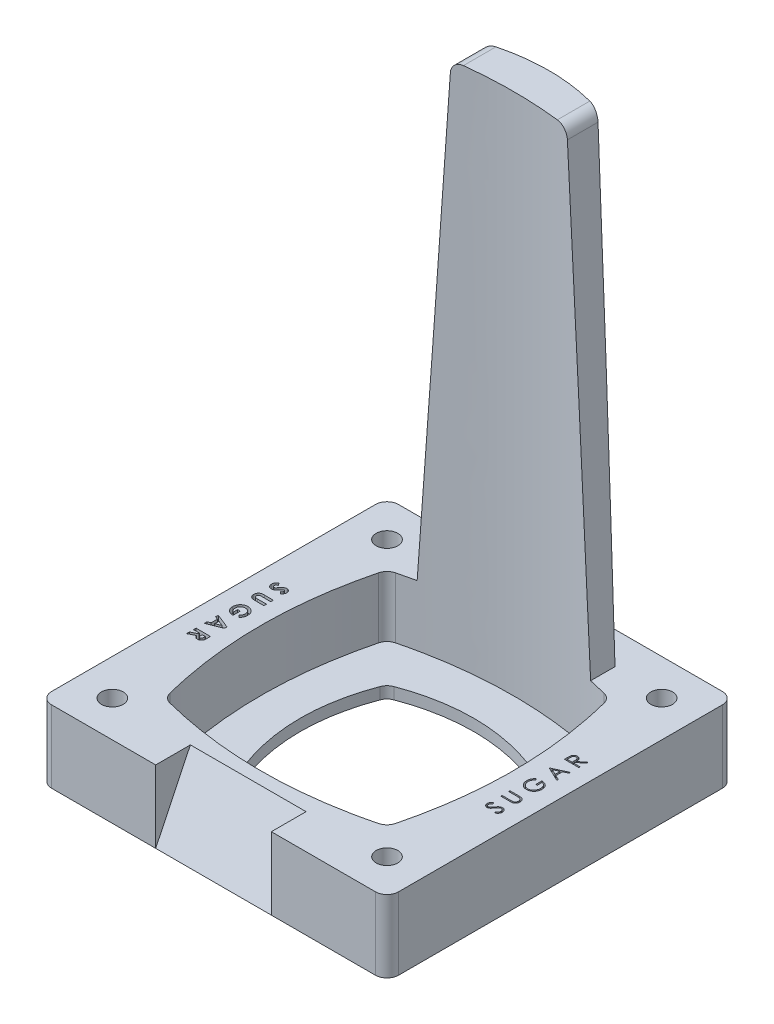
from build123d import *

# Parameters (mm, degrees)
SKETCH1_W           = 76.2
SKETCH1_H           = 76.2
BOSS_EXTRUDE1_DEPTH = 15.875
CUT_EXTRUDE1_DEPTH  = 13.335
SKETCH4_R           = 2.38125
CUT_EXTRUDE3_DEPTH  = 57.171484227
FILLET2_R           = 2.54
CUT_EXTRUDE4_DEPTH  = 56.507136865
FILLET3_R           = 2.54
BOSS_EXTRUDE2_DEPTH = 101.6
CUT_EXTRUDE5_DEPTH  = 130.242391125
FILLET4_R           = 2.54
CUT_EXTRUDE6_DEPTH  = 12.7
CUT_EXTRUDE7_DEPTH  = 1.27


with BuildPart() as part:
    # Sketch1 → Boss-Extrude1 (new body)
    with BuildSketch(Plane(origin=(0, 0, 0), x_dir=(1, 0, 0), z_dir=(0, 1, 0))):
        Rectangle(SKETCH1_W, SKETCH1_H)
    extrude(amount=BOSS_EXTRUDE1_DEPTH)

    # Sketch2 → Cut-Extrude1 (cut)
    with BuildSketch(Plane(origin=(0, 15.875, 0), x_dir=(1, 0, 0), z_dir=(0, 1, 0))):
        with BuildLine():
            add(Edge.make_bspline(
                [(-24.384, 24.384), (-30.988, 0), (-24.384, -24.384)],
                knots=[0, 0, 0, 1, 1, 1], degree=2))
            add(Edge.make_bspline(
                [(24.384, -24.384), (0, -30.988), (-24.384, -24.384)],
                knots=[0, 0, 0, 1, 1, 1], degree=2))
            add(Edge.make_bspline(
                [(24.384, 24.384), (30.988, 0), (24.384, -24.384)],
                knots=[0, 0, 0, 1, 1, 1], degree=2))
            add(Edge.make_bspline(
                [(-24.384, 24.384), (0, 30.988), (24.384, 24.384)],
                knots=[0, 0, 0, 1, 1, 1], degree=2))
        make_face()
    extrude(amount=-CUT_EXTRUDE1_DEPTH, mode=Mode.SUBTRACT)

    # Sketch4 → Cut-Extrude3 (cut, through all)
    with BuildSketch(Plane(origin=(0, 15.875, 0), x_dir=(1, 0, 0), z_dir=(0, 1, 0))):
        with Locations(Location((-30.1625, 30.1625, 0), (0, 0, 270))):
            Circle(SKETCH4_R)
        with Locations(Location((30.1625, 30.1625, 0), (0, 0, 270))):
            Circle(SKETCH4_R)
        with Locations(Location((30.1625, -30.1625, 0), (0, 0, 270))):
            Circle(SKETCH4_R)
        with Locations(Location((-30.1625, -30.1625, 0), (0, 0, 270))):
            Circle(SKETCH4_R)
    extrude(amount=-CUT_EXTRUDE3_DEPTH, mode=Mode.SUBTRACT)

    # Fillet2
    fillet2_edges = [part.edges().sort_by_distance(p)[0] for p in [
        (38.1, 7.9375, 38.1),
        (-38.1, 7.9375, 38.1),
        (-38.1, 7.9375, -38.1),
        (38.1, 7.9375, -38.1),
    ]]
    fillet(fillet2_edges, radius=FILLET2_R)

    # Sketch8 → Cut-Extrude4 (cut, through all)
    with BuildSketch(Plane(origin=(0, 2.54, 0), x_dir=(1, 0, 0), z_dir=(0, 1, 0))):
        with BuildLine():
            add(Edge.make_bspline(
                [(-15.875, 15.875), (-22.225, 0), (-15.875, -15.875)],
                knots=[0, 0, 0, 1, 1, 1], degree=2))
            add(Edge.make_bspline(
                [(15.875, -15.875), (0, -22.225), (-15.875, -15.875)],
                knots=[0, 0, 0, 1, 1, 1], degree=2))
            add(Edge.make_bspline(
                [(15.875, 15.875), (22.225, 0), (15.875, -15.875)],
                knots=[0, 0, 0, 1, 1, 1], degree=2))
            add(Edge.make_bspline(
                [(-15.875, 15.875), (0, 22.225), (15.875, 15.875)],
                knots=[0, 0, 0, 1, 1, 1], degree=2))
        make_face()
    extrude(amount=-CUT_EXTRUDE4_DEPTH, mode=Mode.SUBTRACT)

    # Fillet3
    fillet3_edges = [part.edges().sort_by_distance(p)[0] for p in [
        (15.875, 1.27, -15.875),
        (15.875, 1.27, 15.875),
        (-15.875, 1.27, 15.875),
        (-15.875, 1.27, -15.875),
        (-24.384, 9.2075, -24.384),
        (-24.384, 9.2075, 24.384),
        (24.384, 9.2075, 24.384),
        (24.384, 9.2075, -24.384),
    ]]
    fillet(fillet3_edges, radius=FILLET3_R)

    # Sketch9 → Boss-Extrude2 (add)
    with BuildSketch(Plane(origin=(0, 15.875, 0), x_dir=(1, 0, 0), z_dir=(0, 1, 0))):
        with BuildLine():
            Line((-26.67, 26.67), (-24.384, 24.384))
            add(Edge.make_bspline(
                [(-24.384, 24.384), (0, 30.988), (24.384, 24.384)],
                knots=[0, 0, 0, 1, 1, 1], degree=2))
            Line((24.384, 24.384), (26.67, 26.67))
            add(Edge.make_bspline(
                [(-26.67, 26.67), (0, 44.45), (26.67, 26.67)],
                knots=[0, 0, 0, 1, 1, 1], degree=2))
        make_face()
    extrude(amount=BOSS_EXTRUDE2_DEPTH)

    # Sketch10 → Cut-Extrude5 (cut, through all)
    with BuildSketch(Plane.XY):
        Polygon((-12.7, 117.475), (-19.05, 15.875), (-26.67, 15.875), (-26.67, 117.475), align=None)
        Polygon((12.7, 117.475), (19.05, 15.875), (26.67, 15.875), (26.67, 117.475), align=None)
    extrude(amount=-CUT_EXTRUDE5_DEPTH, mode=Mode.SUBTRACT)

    # Fillet4
    fillet4_edges = [part.edges().sort_by_distance(p)[0] for p in [
        (12.7, 117.475, -30.167201079),
        (-12.7, 117.475, -30.167201079),
    ]]
    fillet(fillet4_edges, radius=FILLET4_R)

    # Sketch11 → Cut-Extrude6 (cut, symmetric)
    with BuildSketch(Plane(origin=(0, 0, 0), x_dir=(0, 0, -1), z_dir=(1, 0, 0))):
        Polygon((-30.48, 15.875), (-38.1, 0), (-38.1, 15.875), align=None)
    extrude(amount=CUT_EXTRUDE6_DEPTH, both=True, mode=Mode.SUBTRACT)

    # Sketch12 → Cut-Extrude7 (cut)
    # profile 1 of 10: a face of its own
    with BuildSketch(Plane(origin=(0, 15.875, 0), x_dir=(1, 0, 0), z_dir=(0, 1, 0))):
        with BuildLine():
            Line((-31.539223758, 8.141025641), (-31.929102564, 8.567157452))
            add(Edge.make_bspline(
                [(-31.929102564, 8.567157452), (-31.90334928, 8.585407599), (-31.853906565, 8.620445336), (-31.787773878, 8.677294942), (-31.730987674, 8.733804911), (-31.685171539, 8.791130647), (-31.648288106, 8.848285183), (-31.622848116, 8.906482796), (-31.606487506, 8.965053963), (-31.604460135, 9.004425412), (-31.603461538, 9.023818109)],
                knots=[0, 0, 0, 0, 1.299459705, 2.494781419, 3.587730629, 4.594196874, 5.512431013, 6.380462003, 7.202284646, 8, 8, 8, 8], degree=3))
            add(Edge.make_bspline(
                [(-31.603461538, 9.023818109), (-31.604095863, 9.041905542), (-31.605320578, 9.076827623), (-31.617494153, 9.126611641), (-31.638503956, 9.1708106), (-31.66597604, 9.209381366), (-31.699073533, 9.239935103), (-31.733784293, 9.264329893), (-31.772097121, 9.278066209), (-31.798411918, 9.279874179), (-31.811439303, 9.280769231)],
                knots=[0, 0, 0, 0, 1.185010067, 2.2879431, 3.333075148, 4.379039566, 5.372662701, 6.27520591, 7.14612461, 8, 8, 8, 8], degree=3))
            add(Edge.make_bspline(
                [(-31.811439303, 9.280769231), (-31.824654549, 9.280208347), (-31.851268217, 9.279078805), (-31.890273863, 9.268168966), (-31.92838692, 9.251724724), (-31.951588151, 9.236011579), (-31.963447516, 9.227979768)],
                knots=[0, 0, 0, 0, 0.967525499, 1.948461899, 2.951351359, 4, 4, 4, 4], degree=3))
            add(Edge.make_bspline(
                [(-31.963447516, 9.227979768), (-31.972664567, 9.220676914), (-31.993881002, 9.20386671), (-32.027514428, 9.17184267), (-32.068440273, 9.131570126), (-32.116434363, 9.082221977), (-32.170871405, 9.023858767), (-32.232069818, 8.955963965), (-32.300413726, 8.879496815), (-32.348070362, 8.825207766), (-32.373042869, 8.796759816)],
                knots=[0, 0, 0, 0, 0.473868417, 1.090782513, 1.870421581, 2.78911798, 3.865477667, 5.087766164, 6.473963263, 8, 8, 8, 8], degree=3))
            add(Edge.make_bspline(
                [(-32.373042869, 8.796759816), (-32.396157108, 8.770052033), (-32.440023131, 8.71936621), (-32.502283908, 8.647250348), (-32.558298411, 8.583872517), (-32.607225982, 8.528309445), (-32.649579984, 8.481403415), (-32.685562867, 8.442957234), (-32.714474112, 8.412501346), (-32.731936522, 8.395188957), (-32.739389022, 8.387800481)],
                knots=[0, 0, 0, 0, 1.543621617, 2.929473131, 4.163658386, 5.240097082, 6.164993805, 6.925417477, 7.541396219, 8, 8, 8, 8], degree=3))
            add(Edge.make_bspline(
                [(-32.739389022, 8.387800481), (-32.769712969, 8.359754162), (-32.828006242, 8.305839289), (-32.918609813, 8.235949035), (-33.006450958, 8.177552189), (-33.094228703, 8.132848154), (-33.182997385, 8.100125542), (-33.274285521, 8.076158756), (-33.369659972, 8.062006264), (-33.434721592, 8.060418475), (-33.467629207, 8.059615385)],
                knots=[0, 0, 0, 0, 1.20648512, 2.3192881, 3.339983362, 4.284774958, 5.190427137, 6.099526693, 7.038756749, 8, 8, 8, 8], degree=3))
            add(Edge.make_bspline(
                [(-33.467629207, 8.059615385), (-33.499695024, 8.060184102), (-33.562609351, 8.061299946), (-33.654679367, 8.074952099), (-33.742778036, 8.094447091), (-33.826022738, 8.124486592), (-33.905400171, 8.161407444), (-33.980936356, 8.206405284), (-34.050870359, 8.26141879), (-34.117079432, 8.322525938), (-34.17653746, 8.391161331), (-34.228852022, 8.465010762), (-34.273370098, 8.54393633), (-34.308628113, 8.628232495), (-34.336940573, 8.717383256), (-34.357059122, 8.811501316), (-34.369491274, 8.910696744), (-34.370761379, 8.978411426), (-34.371410256, 9.013005809)],
                knots=[0, 0, 0, 0, 1.043082113, 2.046565928, 3.024368146, 3.976196322, 4.921091788, 5.871642728, 6.831173094, 7.81279273, 8.801063391, 9.781590382, 10.755046466, 11.74476232, 12.751114423, 13.796272686, 14.874149815, 16, 16, 16, 16], degree=3))
            add(Edge.make_bspline(
                [(-34.371410256, 9.013005809), (-34.370928674, 9.040160522), (-34.369974864, 9.093942427), (-34.362182929, 9.173207696), (-34.349619668, 9.249751594), (-34.331570529, 9.323467822), (-34.308908965, 9.394574787), (-34.280708006, 9.463006394), (-34.247515147, 9.528690183), (-34.209311506, 9.592049092), (-34.164977118, 9.652646409), (-34.115433842, 9.711296813), (-34.059607727, 9.767267726), (-33.998587537, 9.821707113), (-33.930809473, 9.87269009), (-33.858228699, 9.922830747), (-33.779134234, 9.969702021), (-33.723659024, 9.998666914), (-33.695323518, 10.013461538)],
                knots=[0, 0, 0, 0, 1.016957334, 2.014158747, 2.980235577, 3.920141478, 4.854360818, 5.773095257, 6.689355356, 7.608638744, 8.541033765, 9.498850575, 10.481527934, 11.499755671, 12.559141621, 13.65604909, 14.802761907, 16, 16, 16, 16], degree=3))
            Line((-33.695323518, 10.013461538), (-33.394487179, 9.512279647))
            add(Edge.make_bspline(
                [(-33.394487179, 9.512279647), (-33.426652663, 9.493775012), (-33.488316645, 9.458300045), (-33.57117002, 9.398184396), (-33.642120221, 9.336598982), (-33.699913198, 9.272120005), (-33.745321719, 9.205531504), (-33.777773798, 9.136511841), (-33.797861598, 9.065012525), (-33.800314782, 9.016310439), (-33.801538462, 8.992017228)],
                knots=[0, 0, 0, 0, 1.283663364, 2.460892379, 3.537111102, 4.529833553, 5.449777664, 6.316464042, 7.160231139, 8, 8, 8, 8], degree=3))
            add(Edge.make_bspline(
                [(-33.801538462, 8.992017228), (-33.800548635, 8.967303003), (-33.798628227, 8.919353808), (-33.78053993, 8.850799796), (-33.75277678, 8.787671422), (-33.712399548, 8.733397051), (-33.666357758, 8.687307677), (-33.61442987, 8.654266332), (-33.5589196, 8.632833567), (-33.520183941, 8.63060701), (-33.500702123, 8.629487179)],
                knots=[0, 0, 0, 0, 1.13537643, 2.202795631, 3.242191317, 4.290390765, 5.297919085, 6.223733717, 7.106639842, 8, 8, 8, 8], degree=3))
            add(Edge.make_bspline(
                [(-33.500702123, 8.629487179), (-33.482586559, 8.630535373), (-33.445786526, 8.632664677), (-33.391039028, 8.64826312), (-33.336556999, 8.672852869), (-33.291396406, 8.701072495), (-33.253753173, 8.730492975), (-33.221627446, 8.759330681), (-33.185391531, 8.79350835), (-33.146033543, 8.833896849), (-33.102796752, 8.879710627), (-33.055783958, 8.93109967), (-33.005378385, 8.988617389), (-32.971044009, 9.02927266), (-32.953090946, 9.050530849)],
                knots=[0, 0, 0, 0, 0.916057066, 1.860882232, 2.859899639, 3.934694552, 4.546382938, 5.276161949, 6.118633209, 7.067046139, 8.129668089, 9.306861125, 10.591787583, 12, 12, 12, 12], degree=3))
            add(Edge.make_bspline(
                [(-32.953090946, 9.050530849), (-32.918896967, 9.090941967), (-32.853268374, 9.168503134), (-32.756356584, 9.278127012), (-32.665714834, 9.376837279), (-32.580623832, 9.463983851), (-32.501608539, 9.539799125), (-32.42942167, 9.605201374), (-32.362598747, 9.65876647), (-32.283317923, 9.715076786), (-32.187216408, 9.769438979), (-32.070979105, 9.815548253), (-31.955004328, 9.845630872), (-31.877121446, 9.84898845), (-31.838788061, 9.850641026)],
                knots=[0, 0, 0, 0, 1.34561873, 2.582649632, 3.719171478, 4.751946187, 5.678152813, 6.502542634, 7.227205346, 7.853698961, 8.973370308, 10.023159194, 11.027013428, 12, 12, 12, 12], degree=3))
            add(Edge.make_bspline(
                [(-31.838788061, 9.850641026), (-31.811605937, 9.849951217), (-31.758054232, 9.848592221), (-31.679305232, 9.836505232), (-31.603354152, 9.81835775), (-31.530224114, 9.792275067), (-31.460724416, 9.757304368), (-31.393785558, 9.715948535), (-31.329524181, 9.66735393), (-31.270035587, 9.610950817), (-31.214773717, 9.54976376), (-31.166266245, 9.484229394), (-31.125470412, 9.415032002), (-31.09113176, 9.342661067), (-31.065288948, 9.266186565), (-31.046806835, 9.186303502), (-31.03584309, 9.102988861), (-31.034350217, 9.046323442), (-31.033589744, 9.017457933)],
                knots=[0, 0, 0, 0, 1.010961173, 1.991702108, 2.958025473, 3.913824419, 4.873522744, 5.847800578, 6.838738273, 7.865764422, 8.893759806, 9.903642949, 10.894078012, 11.878777586, 12.879248405, 13.891624672, 14.925988217, 16, 16, 16, 16], degree=3))
            add(Edge.make_bspline(
                [(-31.033589744, 9.017457933), (-31.034961925, 8.98005114), (-31.037695458, 8.905532832), (-31.058958268, 8.795322228), (-31.092751805, 8.687622238), (-31.132550524, 8.60056001), (-31.172352352, 8.53189815), (-31.208195551, 8.479098689), (-31.249513552, 8.425267638), (-31.296471034, 8.370127576), (-31.348754388, 8.313958719), (-31.407426808, 8.257233689), (-31.470575803, 8.198570656), (-31.515940238, 8.160543346), (-31.539223758, 8.141025641)],
                knots=[0, 0, 0, 0, 1.282867522, 2.555608537, 3.83715526, 5.14906667, 5.830341525, 6.558732832, 7.337173124, 8.157810814, 9.043130442, 9.96912168, 10.957641678, 12, 12, 12, 12], degree=3))
        make_face()
    # profile 2 of 10: a face of its own
    with BuildSketch(Plane(origin=(0, 15.875, 0), x_dir=(1, 0, 0), z_dir=(0, 1, 0))):
        with BuildLine():
            Line((-31.115, 6.146474359), (-31.115, 5.576602564))
            Line((-31.115, 5.576602564), (-33.180785256, 5.576602564))
            add(Edge.make_bspline(
                [(-33.180785256, 5.576602564), (-33.202202422, 5.576571577), (-33.243569456, 5.576511727), (-33.302917606, 5.573515568), (-33.357470982, 5.570773877), (-33.40716986, 5.565827088), (-33.452035499, 5.558518984), (-33.4923561, 5.551442356), (-33.527409768, 5.541864839), (-33.56731002, 5.527471362), (-33.612140132, 5.505295738), (-33.658863104, 5.469062), (-33.701504597, 5.427251366), (-33.73699776, 5.377138914), (-33.76570853, 5.320816948), (-33.786980033, 5.258594935), (-33.798804165, 5.190560584), (-33.800609335, 5.143518562), (-33.801538462, 5.119305889)],
                knots=[0, 0, 0, 0, 1.155499968, 2.231836252, 3.205919964, 4.102923608, 4.924856345, 5.658536265, 6.31071849, 6.882491295, 7.94666036, 8.992281882, 10.060072772, 11.158554251, 12.289267114, 13.461410017, 14.693379945, 16, 16, 16, 16], degree=3))
            add(Edge.make_bspline(
                [(-33.801538462, 5.119305889), (-33.80079594, 5.093579872), (-33.799348149, 5.043418495), (-33.78483015, 4.971122749), (-33.762251333, 4.903953897), (-33.729368132, 4.843747125), (-33.690550649, 4.790285194), (-33.645226481, 4.745930734), (-33.595712002, 4.709401525), (-33.549093163, 4.686439452), (-33.506592712, 4.673119022), (-33.46829166, 4.664400576), (-33.423479502, 4.656898024), (-33.372354731, 4.650509499), (-33.314586014, 4.646567357), (-33.250590154, 4.642342432), (-33.179944343, 4.640786476), (-33.130751637, 4.640522349), (-33.105099159, 4.640384615)],
                knots=[0, 0, 0, 0, 1.260838023, 2.458420682, 3.603291091, 4.724957099, 5.81103668, 6.833527554, 7.823976978, 8.819602765, 9.36572267, 10.006654001, 10.745469399, 11.594489782, 12.533565386, 13.586096035, 14.741223574, 16, 16, 16, 16], degree=3))
            Line((-33.105099159, 4.640384615), (-31.115, 4.640384615))
            Line((-31.115, 4.640384615), (-31.115, 4.070512821))
            Line((-31.115, 4.070512821), (-33.009060497, 4.070512821))
            add(Edge.make_bspline(
                [(-33.009060497, 4.070512821), (-33.047434781, 4.070581715), (-33.121224787, 4.070714193), (-33.227254913, 4.07318609), (-33.324148949, 4.077714324), (-33.411731269, 4.083335295), (-33.490252067, 4.090075968), (-33.559671284, 4.098799573), (-33.619951709, 4.109471005), (-33.688565593, 4.125464537), (-33.767574304, 4.15302781), (-33.858548604, 4.197478052), (-33.947617534, 4.253901256), (-34.033804373, 4.320590244), (-34.113858845, 4.395893437), (-34.184173435, 4.478116775), (-34.243412889, 4.565886123), (-34.290927405, 4.659916609), (-34.327643501, 4.760879679), (-34.352196692, 4.869484694), (-34.368993762, 4.985434358), (-34.370588612, 5.065392329), (-34.371410256, 5.106585537)],
                knots=[0, 0, 0, 0, 1.170789758, 2.251314523, 3.23554622, 4.130075238, 4.928857907, 5.639700176, 6.263954887, 6.795817153, 7.787924184, 8.809125334, 9.87873356, 10.999178519, 12.129364722, 13.22595565, 14.293390689, 15.352147651, 16.432536881, 17.562186165, 18.74407303, 20, 20, 20, 20], degree=3))
            add(Edge.make_bspline(
                [(-34.371410256, 5.106585537), (-34.370949212, 5.133954476), (-34.370039582, 5.187952831), (-34.362020604, 5.267367315), (-34.350199982, 5.344135367), (-34.332968165, 5.418120412), (-34.310661146, 5.48955127), (-34.283442466, 5.55833452), (-34.250672885, 5.624029009), (-34.213823489, 5.686865402), (-34.173431871, 5.746524137), (-34.129400523, 5.801608656), (-34.083617134, 5.852890513), (-34.035135156, 5.89944726), (-33.984135741, 5.94157942), (-33.930560017, 5.979245157), (-33.874397873, 6.012376723), (-33.814640936, 6.041810659), (-33.74825091, 6.067003073), (-33.672866573, 6.088241273), (-33.587306262, 6.106795448), (-33.491377241, 6.120583821), (-33.385395674, 6.133084439), (-33.269085464, 6.140996642), (-33.142443274, 6.145135871), (-33.054644869, 6.146016923), (-33.009060497, 6.146474359)],
                knots=[0, 0, 0, 0, 1.001195678, 1.975338534, 2.91783225, 3.841754112, 4.752027347, 5.653798756, 6.545402703, 7.435486725, 8.317659034, 9.179053568, 10.013983148, 10.831468265, 11.636005169, 12.432309474, 13.225243684, 14.019732185, 14.86686161, 15.819485008, 16.883051984, 18.067941734, 19.364090787, 20.787286826, 22.331979793, 24, 24, 24, 24], degree=3))
            Line((-33.009060497, 6.146474359), (-31.115, 6.146474359))
        make_face()
    # profile 3 of 10: a face of its own
    with BuildSketch(Plane(origin=(0, 15.875, 0), x_dir=(1, 0, 0), z_dir=(0, 1, 0))):
        with BuildLine():
            Line((-31.619997997, -0.915229367), (-32.032773438, -0.484009415))
            add(Edge.make_bspline(
                [(-32.032773438, -0.484009415), (-31.998592095, -0.449868979), (-31.931522658, -0.382879807), (-31.844227177, -0.273327396), (-31.770008761, -0.159864347), (-31.708981187, -0.042117207), (-31.661642895, 0.080078047), (-31.6277803, 0.20648027), (-31.607695822, 0.337295104), (-31.604884063, 0.425850907), (-31.603461538, 0.470653045)],
                knots=[0, 0, 0, 0, 1.075575784, 2.110457258, 3.113929901, 4.09197124, 5.059417775, 6.02750972, 7.002078037, 8, 8, 8, 8], degree=3))
            add(Edge.make_bspline(
                [(-31.603461538, 0.470653045), (-31.604458351, 0.509495087), (-31.606415679, 0.585764841), (-31.62127787, 0.69783661), (-31.646108724, 0.804925325), (-31.68049312, 0.907549707), (-31.725291024, 1.005036225), (-31.779489678, 1.097977311), (-31.844445032, 1.185310883), (-31.917538405, 1.267410327), (-31.997944993, 1.342000646), (-32.083266332, 1.408023395), (-32.17331387, 1.46348306), (-32.267575185, 1.509276103), (-32.366235758, 1.544071229), (-32.46916554, 1.56892282), (-32.576081131, 1.584694306), (-32.649019467, 1.586556685), (-32.685963542, 1.5875)],
                knots=[0, 0, 0, 0, 1.075079404, 2.111012651, 3.123248818, 4.114352675, 5.101852729, 6.0883232, 7.087285529, 8.109865155, 9.127328517, 10.119283532, 11.091685968, 12.049813832, 13.015105368, 13.981662908, 14.977689899, 16, 16, 16, 16], degree=3))
            add(Edge.make_bspline(
                [(-32.685963542, 1.5875), (-32.724183965, 1.586613998), (-32.799483432, 1.584868452), (-32.910029757, 1.568306159), (-33.016154184, 1.542343185), (-33.117980416, 1.505998354), (-33.215218951, 1.458618363), (-33.307705664, 1.400283143), (-33.395850515, 1.33185493), (-33.478437945, 1.253928512), (-33.554538695, 1.169126299), (-33.620230624, 1.077310422), (-33.676655071, 0.981345383), (-33.722015779, 0.879676119), (-33.757587872, 0.773599475), (-33.783161363, 0.662443386), (-33.798706634, 0.546570012), (-33.800585123, 0.467521319), (-33.801538462, 0.427403846)],
                knots=[0, 0, 0, 0, 1.022020332, 2.013519966, 2.983415422, 3.94151226, 4.900448282, 5.871487551, 6.861996943, 7.881274692, 8.905826162, 9.905469932, 10.896823527, 11.879375057, 12.878487611, 13.885682746, 14.926976999, 16, 16, 16, 16], degree=3))
            add(Edge.make_bspline(
                [(-33.801538462, 0.427403846), (-33.801302776, 0.401308418), (-33.800840072, 0.350077287), (-33.793339692, 0.274928335), (-33.782600639, 0.202959794), (-33.768440666, 0.133864796), (-33.748134477, 0.068251647), (-33.725155673, 0.005229888), (-33.696685927, -0.054372687), (-33.664377774, -0.111075516), (-33.627167763, -0.16493001), (-33.585223239, -0.215762193), (-33.538162345, -0.263743175), (-33.486887221, -0.309699671), (-33.429900242, -0.35207138), (-33.368614053, -0.392357088), (-33.302349655, -0.430028032), (-33.255559944, -0.452289155), (-33.231666667, -0.463656851)],
                knots=[0, 0, 0, 0, 1.109467577, 2.178131716, 3.208562196, 4.204278576, 5.174223432, 6.127254264, 7.054993225, 7.9799672, 8.900446918, 9.835649638, 10.779420865, 11.756673556, 12.761211291, 13.796640546, 14.874849225, 16, 16, 16, 16], degree=3))
            Line((-33.231666667, -0.463656851), (-33.231666667, 0.44775641))
            Line((-33.231666667, 0.44775641), (-32.661794872, 0.44775641))
            Line((-32.661794872, 0.44775641), (-32.661794872, -1.135291466))
            Line((-32.661794872, -1.135291466), (-32.797266627, -1.13974359))
            add(Edge.make_bspline(
                [(-32.797266627, -1.13974359), (-32.832059211, -1.139171525), (-32.901582288, -1.138028416), (-33.005090307, -1.127581603), (-33.107225506, -1.110276616), (-33.207885304, -1.086619043), (-33.307563474, -1.056970118), (-33.405305513, -1.019158459), (-33.501774275, -0.974881236), (-33.596559844, -0.92527175), (-33.687509174, -0.869524961), (-33.773626184, -0.809505357), (-33.854761824, -0.746068559), (-33.92978567, -0.677834842), (-33.999327956, -0.605866718), (-34.063121145, -0.530022516), (-34.121219214, -0.45003398), (-34.174112958, -0.366324841), (-34.220471204, -0.278418294), (-34.260796728, -0.186797649), (-34.295044344, -0.091601242), (-34.323119939, 0.007416702), (-34.344782494, 0.110061342), (-34.359636537, 0.216334876), (-34.369730026, 0.32629567), (-34.370843408, 0.40087975), (-34.371410256, 0.438852163)],
                knots=[0, 0, 0, 0, 1.006889344, 2.011981806, 3.007738725, 4.003571281, 5.003404394, 6.015442001, 7.03424805, 8.074616296, 9.110249922, 10.119753985, 11.111721717, 12.089233633, 13.052717867, 14.006597561, 14.955430184, 15.912305663, 16.870361111, 17.829300583, 18.807640451, 19.796414044, 20.806216501, 21.841577364, 22.90109906, 24, 24, 24, 24], degree=3))
            add(Edge.make_bspline(
                [(-34.371410256, 0.438852163), (-34.370845251, 0.479365208), (-34.369725242, 0.559674146), (-34.359427003, 0.678229113), (-34.342015673, 0.793484217), (-34.318697713, 0.905259317), (-34.288623424, 1.014048673), (-34.252151308, 1.119444216), (-34.2075171, 1.221063889), (-34.157798181, 1.31954387), (-34.100869474, 1.413655447), (-34.038860035, 1.503447217), (-33.970426627, 1.587694113), (-33.896268534, 1.666748891), (-33.817030529, 1.741173337), (-33.731646949, 1.810239125), (-33.640942221, 1.874567435), (-33.544313503, 1.932582811), (-33.444398872, 1.985273217), (-33.341786446, 2.031164345), (-33.237271689, 2.070067381), (-33.130831693, 2.101952853), (-33.022468999, 2.1267531), (-32.912249372, 2.144753312), (-32.800000237, 2.154858657), (-32.724567596, 2.156530363), (-32.686599559, 2.157371795)],
                knots=[0, 0, 0, 0, 1.084269852, 2.149346245, 3.182248965, 4.202856654, 5.203774155, 6.201646532, 7.185249156, 8.172511953, 9.152555749, 10.126997366, 11.091273046, 12.05486384, 13.026475683, 13.998733638, 14.992239644, 16.000514163, 17.013329872, 18.014183023, 19.007154045, 19.996420909, 20.986208491, 21.980735032, 22.983629316, 24, 24, 24, 24], degree=3))
            add(Edge.make_bspline(
                [(-32.686599559, 2.157371795), (-32.634802517, 2.156246696), (-32.532518714, 2.154024959), (-32.381854024, 2.133448306), (-32.23610097, 2.101372369), (-32.095790374, 2.055340169), (-31.960728957, 1.996269987), (-31.830599655, 1.924998605), (-31.705540786, 1.839977854), (-31.628111977, 1.774165953), (-31.588833133, 1.740780248)],
                knots=[0, 0, 0, 0, 1.034044851, 2.041932006, 3.031217818, 4.011390712, 4.986069675, 5.97149666, 6.970960976, 8, 8, 8, 8], degree=3))
            add(Edge.make_bspline(
                [(-31.588833133, 1.740780248), (-31.566109131, 1.72005139), (-31.52100233, 1.678904919), (-31.458325511, 1.613132359), (-31.399406982, 1.545691789), (-31.345496075, 1.475649145), (-31.295412652, 1.40337263), (-31.250095569, 1.328654218), (-31.208101904, 1.251885865), (-31.171576014, 1.172468871), (-31.138827506, 1.090818994), (-31.111117664, 1.006574621), (-31.08657333, 0.920366725), (-31.067901387, 0.83143193), (-31.052352818, 0.740668692), (-31.041931353, 0.647432742), (-31.034293161, 0.551978154), (-31.033826071, 0.487417472), (-31.033589744, 0.454752604)],
                knots=[0, 0, 0, 0, 1.020590567, 2.025856924, 3.013483481, 3.991664875, 4.957826714, 5.930500614, 6.890802512, 7.860442893, 8.829981142, 9.809047939, 10.802672283, 11.803273349, 12.823572789, 13.857849586, 14.916166035, 16, 16, 16, 16], degree=3))
            add(Edge.make_bspline(
                [(-31.033589744, 0.454752604), (-31.034116324, 0.420607212), (-31.035164026, 0.352670419), (-31.042413442, 0.251659659), (-31.053597581, 0.152052512), (-31.070374429, 0.05426873), (-31.091063774, -0.042019847), (-31.117571945, -0.136314808), (-31.147690003, -0.229231311), (-31.171702344, -0.289719603), (-31.183689904, -0.319916867)],
                knots=[0, 0, 0, 0, 1.03180557, 2.052914215, 3.058998889, 4.059601663, 5.049854447, 6.033765722, 7.018406786, 8, 8, 8, 8], degree=3))
            add(Edge.make_bspline(
                [(-31.183689904, -0.319916867), (-31.194768567, -0.34532413), (-31.217302261, -0.397001799), (-31.258528711, -0.472186438), (-31.304232962, -0.547554774), (-31.356086068, -0.622293544), (-31.41399104, -0.696288868), (-31.477033278, -0.770313334), (-31.545947891, -0.843611274), (-31.594994961, -0.891047501), (-31.619997997, -0.915229367)],
                knots=[0, 0, 0, 0, 0.894392155, 1.819168899, 2.76525314, 3.739198753, 4.75366411, 5.797420238, 6.877176959, 8, 8, 8, 8], degree=3))
        make_face()
    # profile 4 of 10: a face of its own
    with BuildSketch(Plane(origin=(0, 15.875, 0), x_dir=(1, 0, 0), z_dir=(0, 1, 0))):
        Polygon((-31.115, -4.03044371), (-31.115, -4.558974359), (-34.29, -5.841185897), (-34.29, -5.232517027), (-33.638717949, -4.985742187), (-33.638717949, -3.602403846), (-34.29, -3.355629006), (-34.29, -2.747596154), align=None)
        Polygon((-31.966627604, -4.294391026), (-33.068846154, -3.81864984), (-33.068846154, -4.770132212), align=None, mode=Mode.SUBTRACT)
    # profile 5 of 10: a face of its own
    with BuildSketch(Plane(origin=(0, 15.875, 0), x_dir=(1, 0, 0), z_dir=(0, 1, 0))):
        with BuildLine():
            Line((-31.115, -7.652564103), (-31.115, -8.316566506))
            add(Edge.make_bspline(
                [(-31.115, -8.316566506), (-31.115155307, -8.360456933), (-31.115454007, -8.444870588), (-31.120187542, -8.566589342), (-31.12674457, -8.678408734), (-31.136873334, -8.780685816), (-31.149971029, -8.873015925), (-31.165861196, -8.955594617), (-31.183812761, -9.028469844), (-31.205815187, -9.092625838), (-31.231153419, -9.150363716), (-31.259752993, -9.204032837), (-31.292694594, -9.254579235), (-31.328643444, -9.302930679), (-31.368887102, -9.348224121), (-31.413099442, -9.390334064), (-31.460961781, -9.429801971), (-31.512186312, -9.46668007), (-31.566701524, -9.499497366), (-31.623733346, -9.528571871), (-31.683435891, -9.552459308), (-31.745467376, -9.572349141), (-31.809902394, -9.587663102), (-31.87669911, -9.598060715), (-31.94588592, -9.605748798), (-31.99289378, -9.606186818), (-32.016872997, -9.606410256)],
                knots=[0, 0, 0, 0, 1.749037589, 3.363891962, 4.853828513, 6.212420965, 7.458679178, 8.568887289, 9.562757098, 10.447168552, 11.268163578, 12.073310924, 12.867792413, 13.67045336, 14.472446998, 15.279188696, 16.101356728, 16.943088626, 17.792208908, 18.634830833, 19.491484118, 20.351879174, 21.228996054, 22.12769993, 23.044919519, 24, 24, 24, 24], degree=3))
            add(Edge.make_bspline(
                [(-32.016872997, -9.606410256), (-32.041901303, -9.605826091), (-32.090977249, -9.604680648), (-32.163065812, -9.598510672), (-32.232035106, -9.587233894), (-32.297683199, -9.570153573), (-32.360827157, -9.550521962), (-32.420301934, -9.524416955), (-32.476972505, -9.494954875), (-32.530037244, -9.459963624), (-32.580674824, -9.421562435), (-32.626945132, -9.37690266), (-32.671335022, -9.328877566), (-32.711064061, -9.274787488), (-32.748818583, -9.217016767), (-32.783034235, -9.15441756), (-32.814571119, -9.087398409), (-32.832158263, -9.040280628), (-32.841151843, -9.016185897)],
                knots=[0, 0, 0, 0, 1.099860209, 2.156625411, 3.176576793, 4.16617041, 5.135385252, 6.078461593, 7.016046972, 7.938469504, 8.868247731, 9.803980173, 10.76021508, 11.73834243, 12.748633912, 13.790971185, 14.870363756, 16, 16, 16, 16], degree=3))
            Line((-32.841151843, -9.016185897), (-34.29, -9.748878205))
            Line((-34.29, -9.748878205), (-34.29, -9.115404647))
            Line((-34.29, -9.115404647), (-32.906025641, -8.415785256))
            Line((-32.906025641, -8.415785256), (-32.906025641, -8.222435897))
            Line((-32.906025641, -8.222435897), (-34.29, -8.222435897))
            Line((-34.29, -8.222435897), (-34.29, -7.652564103))
            Line((-34.29, -7.652564103), (-31.115, -7.652564103))
        make_face()
        with BuildLine():
            Line((-32.336153846, -8.222435897), (-32.336153846, -8.44440605))
            add(Edge.make_bspline(
                [(-32.336153846, -8.44440605), (-32.335848208, -8.47154375), (-32.335262976, -8.523506616), (-32.332548329, -8.598235972), (-32.326007705, -8.666108291), (-32.317743006, -8.727413994), (-32.308202923, -8.782464923), (-32.294522214, -8.830759344), (-32.279889692, -8.87307537), (-32.261618104, -8.908805429), (-32.24120474, -8.939456946), (-32.216991472, -8.965149179), (-32.190467122, -8.987783111), (-32.159962233, -9.005537364), (-32.126726585, -9.019881656), (-32.090134881, -9.028777523), (-32.050849658, -9.03583555), (-32.02348222, -9.036297877), (-32.009240785, -9.036538462)],
                knots=[0, 0, 0, 0, 1.688935225, 3.233948049, 4.651771667, 5.929878493, 7.083962697, 8.124219224, 9.050753627, 9.864999381, 10.615157594, 11.334035464, 12.05533055, 12.777108108, 13.522027315, 14.29964284, 15.115170198, 16, 16, 16, 16], degree=3))
            add(Edge.make_bspline(
                [(-32.009240785, -9.036538462), (-31.992414053, -9.035892096), (-31.959361056, -9.03462243), (-31.911776984, -9.022022703), (-31.86773214, -9.001968226), (-31.827437854, -8.974473339), (-31.792076669, -8.939868425), (-31.76115928, -8.90022367), (-31.73614174, -8.854954225), (-31.720119267, -8.812739728), (-31.710270819, -8.77406635), (-31.703279693, -8.739278306), (-31.697859049, -8.69888409), (-31.692611467, -8.653109099), (-31.688999424, -8.60175648), (-31.686443719, -8.544921075), (-31.68538327, -8.482570762), (-31.685047196, -8.439105984), (-31.684871795, -8.416421274)],
                knots=[0, 0, 0, 0, 1.020213939, 2.004021227, 2.966357326, 3.948562114, 4.950324333, 5.960000531, 6.991850424, 8.080015304, 8.69218159, 9.414443227, 10.233931419, 11.166782034, 12.212677862, 13.359889063, 14.622099264, 16, 16, 16, 16], degree=3))
            Line((-31.684871795, -8.416421274), (-31.684871795, -8.222435897))
            Line((-31.684871795, -8.222435897), (-32.336153846, -8.222435897))
        make_face(mode=Mode.SUBTRACT)
    # profile 6 of 10: a face of its own
    with BuildSketch(Plane(origin=(0, 15.875, 0), x_dir=(1, 0, 0), z_dir=(0, 1, 0))):
        with BuildLine():
            Line((31.115, 7.856089744), (31.115, 8.491471354))
            add(Edge.make_bspline(
                [(31.115, 8.491471354), (31.115141139, 8.533872235), (31.115412141, 8.615286623), (31.116923226, 8.731920947), (31.121254248, 8.837899814), (31.12498132, 8.933167811), (31.131777582, 9.017723191), (31.138273311, 9.091825233), (31.146776561, 9.155132644), (31.154673623, 9.193455666), (31.158249199, 9.210807292)],
                knots=[0, 0, 0, 0, 1.410062039, 2.707475311, 3.878576406, 4.937260626, 5.877586885, 6.699081471, 7.410979367, 8, 8, 8, 8], degree=3))
            add(Edge.make_bspline(
                [(31.158249199, 9.210807292), (31.163988494, 9.23403614), (31.17534465, 9.279998302), (31.199347064, 9.346174695), (31.227124265, 9.409233151), (31.259745481, 9.468917445), (31.297470946, 9.524907538), (31.339582231, 9.577859587), (31.385994279, 9.627601708), (31.43712548, 9.673484727), (31.49188641, 9.715162618), (31.550126776, 9.751720548), (31.611605764, 9.782611327), (31.676419134, 9.806852659), (31.743850925, 9.8271938), (31.814589378, 9.840860541), (31.888398347, 9.849373586), (31.938618981, 9.850214591), (31.964083534, 9.850641026)],
                knots=[0, 0, 0, 0, 1.02737844, 2.032840108, 3.019645024, 3.985760442, 4.950801802, 5.916702504, 6.889791722, 7.870143693, 8.864820395, 9.842884691, 10.820524757, 11.815201459, 12.812418953, 13.84314332, 14.906358105, 16, 16, 16, 16], degree=3))
            add(Edge.make_bspline(
                [(31.964083534, 9.850641026), (32.006388236, 9.849308434), (32.088935667, 9.846708204), (32.208733752, 9.822464717), (32.320484059, 9.78275316), (32.42404588, 9.728031319), (32.517400537, 9.658345081), (32.599397593, 9.574593306), (32.668013799, 9.476729272), (32.715595987, 9.385625536), (32.746069554, 9.305149083), (32.767511108, 9.238897435), (32.784077319, 9.166628106), (32.798918296, 9.089033524), (32.810123047, 9.005790779), (32.818329601, 8.917099386), (32.823458631, 8.822896091), (32.824222449, 8.758181364), (32.824615385, 8.724889824)],
                knots=[0, 0, 0, 0, 1.260483769, 2.459530307, 3.627416485, 4.787058657, 5.939039949, 7.08810263, 8.267026773, 9.491475466, 10.141966685, 10.831826277, 11.566392101, 12.351337768, 13.187381173, 14.07005841, 15.007169909, 16, 16, 16, 16], degree=3))
            Line((32.824615385, 8.724889824), (34.29, 9.891346154))
            Line((34.29, 9.891346154), (34.29, 9.538992388))
            Line((34.29, 9.538992388), (32.824615385, 8.372536058))
            Line((32.824615385, 8.372536058), (32.824615385, 8.141025641))
            Line((32.824615385, 8.141025641), (34.29, 8.141025641))
            Line((34.29, 8.141025641), (34.29, 7.856089744))
            Line((34.29, 7.856089744), (31.115, 7.856089744))
        make_face()
        with BuildLine():
            Line((31.440641026, 8.141025641), (32.498974359, 8.141025641))
            Line((32.498974359, 8.141025641), (32.503426482, 8.722345753))
            add(Edge.make_bspline(
                [(32.503426482, 8.722345753), (32.503438497, 8.749487506), (32.503461784, 8.802095954), (32.499838764, 8.878205795), (32.495717647, 8.949072059), (32.489412525, 9.01442277), (32.481291614, 9.074290156), (32.471117407, 9.128634357), (32.459314795, 9.177576504), (32.440857817, 9.234472342), (32.412893117, 9.298756458), (32.369458913, 9.367091851), (32.317269522, 9.427050675), (32.255868282, 9.475882684), (32.189430269, 9.516795953), (32.117275034, 9.544328955), (32.041743223, 9.562678532), (31.989846986, 9.564684631), (31.963447516, 9.565705128)],
                knots=[0, 0, 0, 0, 1.146477201, 2.22219935, 3.21835465, 4.145220026, 4.995151787, 5.769831222, 6.480173269, 7.120302478, 8.295254187, 9.430763426, 10.528629691, 11.636497428, 12.733230534, 13.811001502, 14.886462612, 16, 16, 16, 16], degree=3))
            add(Edge.make_bspline(
                [(31.963447516, 9.565705128), (31.937916635, 9.564611485), (31.887323744, 9.562444284), (31.813219646, 9.544847615), (31.743258499, 9.514764351), (31.677349974, 9.475189683), (31.618457076, 9.425523306), (31.567520325, 9.368405481), (31.525821582, 9.3038472), (31.498107086, 9.244040167), (31.481831585, 9.190155227), (31.470002041, 9.143592459), (31.461791897, 9.090722289), (31.454015393, 9.031785154), (31.447720103, 8.966668575), (31.443377698, 8.895181702), (31.44083459, 8.817767374), (31.440707049, 8.7641129), (31.440641026, 8.736338141)],
                knots=[0, 0, 0, 0, 1.100823979, 2.181431445, 3.263702604, 4.376021382, 5.48638238, 6.575013887, 7.666064109, 8.791843368, 9.405226397, 10.093019944, 10.863016055, 11.711746407, 12.658404307, 13.684961631, 14.801597923, 16, 16, 16, 16], degree=3))
            Line((31.440641026, 8.736338141), (31.440641026, 8.141025641))
        make_face(mode=Mode.SUBTRACT)
    # profile 7 of 10: a face of its own
    with BuildSketch(Plane(origin=(0, 15.875, 0), x_dir=(1, 0, 0), z_dir=(0, 1, 0))):
        Polygon((31.115, 4.558974359), (34.29, 6.024358974), (34.29, 5.714618389), (33.272371795, 5.24523738), (33.272371795, 3.805929487), (34.29, 3.323192107), (34.29, 3.012179487), (31.115, 4.518269231), align=None)
        Polygon((31.733845152, 4.535441707), (32.946730769, 3.960481771), (32.946730769, 5.09513722), align=None, mode=Mode.SUBTRACT)
    # profile 8 of 10: a face of its own
    with BuildSketch(Plane(origin=(0, 15.875, 0), x_dir=(1, 0, 0), z_dir=(0, 1, 0))):
        with BuildLine():
            Line((31.656887019, 1.058333333), (31.888397436, 0.814102564))
            add(Edge.make_bspline(
                [(31.888397436, 0.814102564), (31.846808363, 0.76991647), (31.764621932, 0.682597924), (31.658157161, 0.539995119), (31.56605229, 0.391808023), (31.491670577, 0.237797029), (31.433321641, 0.082000686), (31.390907303, -0.072902079), (31.364046658, -0.225908321), (31.360820478, -0.327657367), (31.359230769, -0.377794471)],
                knots=[0, 0, 0, 0, 1.089067066, 2.152164705, 3.18986567, 4.218445106, 5.218487318, 6.173592265, 7.100032889, 8, 8, 8, 8], degree=3))
            add(Edge.make_bspline(
                [(31.359230769, -0.377794471), (31.359605969, -0.408559949), (31.360355395, -0.470011113), (31.369920505, -0.561289591), (31.383677203, -0.651610754), (31.40358162, -0.740804101), (31.428808409, -0.829043055), (31.460363797, -0.916020717), (31.497153186, -1.001899361), (31.539664186, -1.085869964), (31.586363607, -1.167277629), (31.638115346, -1.244163426), (31.693257408, -1.317021931), (31.753182608, -1.384467283), (31.817303368, -1.446948121), (31.88446493, -1.505613685), (31.955987766, -1.559370588), (32.031577759, -1.607254704), (32.109476342, -1.650496021), (32.189022857, -1.687863231), (32.269478856, -1.720347976), (32.351450158, -1.745089354), (32.434091672, -1.766045148), (32.51783648, -1.780633126), (32.602903272, -1.788884784), (32.659869755, -1.790309444), (32.688507612, -1.791025641)],
                knots=[0, 0, 0, 0, 1.028150113, 2.053633673, 3.06513288, 4.081487945, 5.106702018, 6.131327874, 7.172780699, 8.228344599, 9.276313556, 10.308389736, 11.324843658, 12.329040066, 13.321460474, 14.316307835, 15.308626991, 16.309440696, 17.305625405, 18.28535951, 19.246194545, 20.203493668, 21.145557131, 22.095268976, 23.042464743, 24, 24, 24, 24], degree=3))
            add(Edge.make_bspline(
                [(32.688507612, -1.791025641), (32.717781712, -1.790339664), (32.776249974, -1.788969583), (32.863513853, -1.780212754), (32.94947161, -1.763924814), (33.034258445, -1.742324155), (33.118043099, -1.714862513), (33.200738136, -1.68112359), (33.282335517, -1.640931599), (33.36202522, -1.594511948), (33.439586055, -1.543249787), (33.513257374, -1.486869785), (33.582181833, -1.42527702), (33.647366164, -1.359600835), (33.708398988, -1.289242839), (33.764544646, -1.213520421), (33.816671324, -1.133493555), (33.864206368, -1.049126739), (33.906667337, -0.9613117), (33.944426442, -0.871271937), (33.975522622, -0.778718055), (34.000866493, -0.684136922), (34.021640329, -0.587641163), (34.035004795, -0.488741001), (34.044702905, -0.388163615), (34.045411992, -0.320364998), (34.045769231, -0.286207933)],
                knots=[0, 0, 0, 0, 0.935915162, 1.869274651, 2.799799983, 3.730201895, 4.664668062, 5.616159355, 6.583070886, 7.570012957, 8.562524459, 9.553461134, 10.53281078, 11.515274572, 12.509912756, 13.507571325, 14.526460018, 15.561318395, 16.601025881, 17.643204557, 18.680545676, 19.719612342, 20.772381578, 21.833430283, 22.908478249, 24, 24, 24, 24], degree=3))
            add(Edge.make_bspline(
                [(34.045769231, -0.286207933), (34.044909093, -0.245043121), (34.043220074, -0.164209327), (34.030061176, -0.04538829), (34.009535735, 0.068741728), (33.979383168, 0.177809181), (33.941217446, 0.282209889), (33.894020092, 0.381558803), (33.838287698, 0.476130255), (33.775148837, 0.565514905), (33.7048013, 0.647587767), (33.629567672, 0.722283796), (33.548473245, 0.787034403), (33.46272661, 0.843773755), (33.371507583, 0.89067054), (33.275323623, 0.929175016), (33.174115214, 0.958686601), (33.104182192, 0.970801575), (33.068846154, 0.976923077)],
                knots=[0, 0, 0, 0, 1.130199668, 2.219330667, 3.279027493, 4.311506524, 5.322739849, 6.327972234, 7.327472899, 8.33386792, 9.329086447, 10.29244429, 11.240784345, 12.174119183, 13.111530729, 14.052100829, 15.015757696, 16, 16, 16, 16], degree=3))
            Line((33.068846154, 0.976923077), (33.068846154, -0.081410256))
            Line((33.068846154, -0.081410256), (32.743205128, -0.081410256))
            Line((32.743205128, -0.081410256), (32.743205128, 1.261858974))
            add(Edge.make_bspline(
                [(32.743205128, 1.261858974), (32.803899779, 1.260311526), (32.922690174, 1.257282891), (33.095927491, 1.236038589), (33.259550384, 1.20173361), (33.413731171, 1.154870327), (33.558251358, 1.094204894), (33.69325768, 1.020388386), (33.817877955, 0.93223939), (33.933129551, 0.832897776), (34.035935336, 0.721409957), (34.126292151, 0.600788423), (34.202403809, 0.470833887), (34.264325982, 0.331669276), (34.312653106, 0.183750169), (34.346917322, 0.026734281), (34.367445931, -0.139165456), (34.370068825, -0.252863728), (34.371410256, -0.31101262)],
                knots=[0, 0, 0, 0, 1.140356446, 2.231883559, 3.274166699, 4.278491846, 5.25512956, 6.21435461, 7.1637429, 8.11826594, 9.068280886, 10.0076534, 10.945064095, 11.891975133, 12.864533718, 13.863980011, 14.907571808, 16, 16, 16, 16], degree=3))
            add(Edge.make_bspline(
                [(34.371410256, -0.31101262), (34.370893982, -0.346853957), (34.369875723, -0.417544625), (34.362639129, -0.521948539), (34.351498892, -0.623473809), (34.334675816, -0.722105646), (34.31407038, -0.818206856), (34.28768457, -0.911297479), (34.25714225, -1.001732131), (34.222402604, -1.08965059), (34.182151172, -1.174254857), (34.137420285, -1.255921769), (34.088440593, -1.335102754), (34.03436504, -1.411258454), (33.975598094, -1.484785668), (33.912021968, -1.555210292), (33.843831024, -1.622926581), (33.795408636, -1.665345001), (33.771009615, -1.68671875)],
                knots=[0, 0, 0, 0, 1.107784379, 2.184907829, 3.233506516, 4.263428166, 5.276301166, 6.270063455, 7.25232949, 8.225834625, 9.190232166, 10.146266622, 11.1027726, 12.066435141, 13.031522626, 14.010570082, 14.99756817, 16, 16, 16, 16], degree=3))
            add(Edge.make_bspline(
                [(33.771009615, -1.68671875), (33.732301237, -1.717730274), (33.655527, -1.779238563), (33.532518479, -1.858412319), (33.405153935, -1.92590502), (33.273078808, -1.980667259), (33.136416636, -2.023428237), (32.99534205, -2.054095338), (32.849673385, -2.072063379), (32.751098467, -2.074651945), (32.701227965, -2.075961538)],
                knots=[0, 0, 0, 0, 1.023165419, 2.029347347, 3.013907458, 3.994755782, 4.975994455, 5.96558838, 6.970761222, 8, 8, 8, 8], degree=3))
            add(Edge.make_bspline(
                [(32.701227965, -2.075961538), (32.663884293, -2.075478723), (32.589671563, -2.074519227), (32.479492436, -2.06288465), (32.37126966, -2.04619194), (32.265091731, -2.021656379), (32.160887625, -1.990726267), (32.058609374, -1.952123909), (31.958195052, -1.907180625), (31.860341746, -1.854938524), (31.76632581, -1.796819027), (31.676607323, -1.733674939), (31.592640349, -1.665019025), (31.514230378, -1.590651368), (31.440215273, -1.512071088), (31.372141095, -1.427628515), (31.308942597, -1.338603024), (31.251834135, -1.24430449), (31.200519011, -1.146220911), (31.155535539, -1.044565497), (31.118357539, -0.939375191), (31.086812829, -0.831436478), (31.063485502, -0.719932765), (31.046568432, -0.605673094), (31.034992743, -0.488061922), (31.034061783, -0.408563524), (31.033589744, -0.368254207)],
                knots=[0, 0, 0, 0, 1.00895651, 2.005089799, 2.991467152, 3.967318338, 4.948153826, 5.927364234, 6.919980553, 7.91976625, 8.923240147, 9.905815003, 10.88314567, 11.851989312, 12.825009789, 13.798721852, 14.781296708, 15.773896486, 16.776076962, 17.771600213, 18.775744723, 19.78957137, 20.808953803, 21.851964491, 22.910847925, 24, 24, 24, 24], degree=3))
            add(Edge.make_bspline(
                [(31.033589744, -0.368254207), (31.034115425, -0.335380943), (31.035157791, -0.270197124), (31.042382864, -0.173200209), (31.053834528, -0.077702546), (31.069461684, 0.016437465), (31.090746603, 0.10889924), (31.116217619, 0.19994618), (31.145873772, 0.289710266), (31.181242226, 0.377910178), (31.221386585, 0.465138963), (31.266574476, 0.551881633), (31.317578587, 0.637841806), (31.374550366, 0.723168553), (31.436511323, 0.808399939), (31.505233585, 0.892187864), (31.578007085, 0.976554821), (31.630333066, 1.03080361), (31.656887019, 1.058333333)],
                knots=[0, 0, 0, 0, 0.985871117, 1.954866573, 2.915460327, 3.869826059, 4.81536089, 5.759505086, 6.70452669, 7.649098992, 8.607881297, 9.583363685, 10.581137262, 11.603961102, 12.659522466, 13.73993555, 14.853081303, 16, 16, 16, 16], degree=3))
        make_face()
    # profile 9 of 10: a face of its own
    with BuildSketch(Plane(origin=(0, 15.875, 0), x_dir=(1, 0, 0), z_dir=(0, 1, 0))):
        with BuildLine():
            Line((31.115, -6.146474359), (31.115, -5.861538462))
            Line((31.115, -5.861538462), (33.017328726, -5.861538462))
            add(Edge.make_bspline(
                [(33.017328726, -5.861538462), (33.044253393, -5.861580865), (33.09534759, -5.861661333), (33.168071691, -5.861123838), (33.232725993, -5.859618554), (33.289559716, -5.858669538), (33.338312065, -5.856558314), (33.379247168, -5.854836514), (33.412171195, -5.852622581), (33.431385321, -5.849961824), (33.439644431, -5.848818109)],
                knots=[0, 0, 0, 0, 1.528628734, 2.90083645, 4.128790002, 5.200304208, 6.127813768, 6.898992206, 7.526736466, 8, 8, 8, 8], degree=3))
            add(Edge.make_bspline(
                [(33.439644431, -5.848818109), (33.469669596, -5.844174914), (33.527631826, -5.835211433), (33.610111676, -5.81139714), (33.684583494, -5.77964885), (33.752727101, -5.740263198), (33.814109435, -5.690499256), (33.869201615, -5.628715785), (33.919266404, -5.55602048), (33.962915702, -5.473454852), (33.999170122, -5.38548103), (34.026297733, -5.295252875), (34.042899813, -5.204511789), (34.044817129, -5.143753242), (34.045769231, -5.113581731)],
                knots=[0, 0, 0, 0, 1.042777144, 2.01303441, 2.939567723, 3.817555404, 4.708046775, 5.641195415, 6.651191522, 7.732783915, 8.843021186, 9.914367358, 10.964315445, 12, 12, 12, 12], degree=3))
            add(Edge.make_bspline(
                [(34.045769231, -5.113581731), (34.044800495, -5.087677132), (34.042868619, -5.036017552), (34.030758183, -4.959301349), (34.009362527, -4.884348047), (33.980217736, -4.811746471), (33.944377457, -4.742676519), (33.901441385, -4.678909058), (33.851429177, -4.621763059), (33.796001847, -4.569614149), (33.733541655, -4.524470025), (33.665555461, -4.48455556), (33.590230443, -4.452856136), (33.53732571, -4.436806814), (33.510242388, -4.428590745)],
                knots=[0, 0, 0, 0, 0.994718802, 1.98369237, 2.973235266, 3.981451368, 4.982709966, 5.955777334, 6.925228988, 7.892833478, 8.871333226, 9.877970804, 10.913677552, 12, 12, 12, 12], degree=3))
            add(Edge.make_bspline(
                [(33.510242388, -4.428590745), (33.499040467, -4.425869203), (33.474078072, -4.41980451), (33.431876616, -4.414137548), (33.382084122, -4.4082352), (33.324342834, -4.40413984), (33.258846238, -4.400147304), (33.185253133, -4.397758731), (33.103830747, -4.396654708), (33.047009893, -4.396325705), (33.017328726, -4.396153846)],
                knots=[0, 0, 0, 0, 0.558680831, 1.244966039, 2.062412453, 2.990489873, 4.051219941, 5.244515665, 6.560634259, 8, 8, 8, 8], degree=3))
            Line((33.017328726, -4.396153846), (31.115, -4.396153846))
            Line((31.115, -4.396153846), (31.115, -4.111217949))
            Line((31.115, -4.111217949), (33.032593149, -4.111217949))
            add(Edge.make_bspline(
                [(33.032593149, -4.111217949), (33.067153815, -4.111448505), (33.134601055, -4.11189845), (33.233435597, -4.115799231), (33.32719118, -4.12202112), (33.415882326, -4.130804069), (33.49918507, -4.14246804), (33.577648105, -4.155319076), (33.650838838, -4.171970846), (33.719601701, -4.191276771), (33.785388284, -4.21303191), (33.84770072, -4.241703802), (33.908369131, -4.273867186), (33.966714194, -4.311705713), (34.022365216, -4.355237291), (34.07676279, -4.402794175), (34.128285721, -4.456052608), (34.177569462, -4.513439503), (34.223403354, -4.574569017), (34.263289231, -4.639835863), (34.295767149, -4.708879709), (34.324591942, -4.780065647), (34.34507987, -4.855100402), (34.360657778, -4.93304931), (34.369434807, -5.014374724), (34.370746191, -5.06967702), (34.371410256, -5.09768129)],
                knots=[0, 0, 0, 0, 1.316707045, 2.569633854, 3.76780728, 4.896239288, 5.964314126, 6.972204208, 7.924543903, 8.822147865, 9.693191779, 10.560896119, 11.431827672, 12.307838457, 13.206132673, 14.12176355, 15.058527151, 16.026630406, 17.00238624, 17.966538933, 18.934743273, 19.906713913, 20.888635248, 21.892958714, 22.933025263, 24, 24, 24, 24], degree=3))
            add(Edge.make_bspline(
                [(34.371410256, -5.09768129), (34.370698856, -5.128224199), (34.36930309, -5.188149277), (34.361292607, -5.27644565), (34.346242813, -5.361106471), (34.326955766, -5.442958007), (34.300789681, -5.521209481), (34.268638541, -5.595837833), (34.231933129, -5.667699953), (34.188559899, -5.735176803), (34.14126431, -5.798821918), (34.089315292, -5.856660775), (34.034691329, -5.910161619), (33.975335554, -5.956966252), (33.912463035, -5.99884498), (33.845778052, -6.034874986), (33.77537, -6.065823501), (33.726426352, -6.081794775), (33.701683694, -6.08986879)],
                knots=[0, 0, 0, 0, 1.138939089, 2.234594419, 3.301501784, 4.342532435, 5.367382236, 6.373123747, 7.370098489, 8.372230273, 9.360297234, 10.323289009, 11.268038109, 12.20748145, 13.137029304, 14.081414587, 15.030090602, 16, 16, 16, 16], degree=3))
            add(Edge.make_bspline(
                [(33.701683694, -6.08986879), (33.684781287, -6.094565212), (33.64811959, -6.104751856), (33.58744399, -6.115660519), (33.517580457, -6.1248309), (33.438524211, -6.133453799), (33.350213975, -6.138541926), (33.25268803, -6.143002745), (33.14582845, -6.146505785), (33.071393282, -6.146485127), (33.032593149, -6.146474359)],
                knots=[0, 0, 0, 0, 0.625038921, 1.35572334, 2.194682327, 3.136881307, 4.189498639, 5.346923369, 6.617055217, 8, 8, 8, 8], degree=3))
            Line((33.032593149, -6.146474359), (31.115, -6.146474359))
        make_face()
    # profile 10 of 10: a face of its own
    with BuildSketch(Plane(origin=(0, 15.875, 0), x_dir=(1, 0, 0), z_dir=(0, 1, 0))):
        with BuildLine():
            Line((33.677515024, -10.013461538), (33.516602564, -9.745062099))
            add(Edge.make_bspline(
                [(33.516602564, -9.745062099), (33.558389542, -9.720099127), (33.638451779, -9.672271035), (33.746635858, -9.592486588), (33.838585815, -9.509816019), (33.913766737, -9.423647123), (33.972956799, -9.33450587), (34.014868823, -9.241810336), (34.04100903, -9.145872893), (34.044184108, -9.080582355), (34.045769231, -9.047986779)],
                knots=[0, 0, 0, 0, 1.272034388, 2.437168799, 3.508375237, 4.49857839, 5.41946034, 6.295179144, 7.148887113, 8, 8, 8, 8], degree=3))
            add(Edge.make_bspline(
                [(34.045769231, -9.047986779), (34.044975476, -9.020155048), (34.043401854, -8.964978577), (34.028892285, -8.883590718), (34.005154659, -8.80494233), (33.972975737, -8.729815227), (33.933420845, -8.660199785), (33.886778206, -8.598174887), (33.832884305, -8.545801436), (33.773735657, -8.502383212), (33.71030847, -8.468786505), (33.644955763, -8.443393788), (33.576780848, -8.429172499), (33.53086809, -8.427038471), (33.507698317, -8.425961538)],
                knots=[0, 0, 0, 0, 1.09553864, 2.171907928, 3.244545276, 4.325730702, 5.384330216, 6.391480148, 7.371786628, 8.333890167, 9.27165687, 10.191402356, 11.087295184, 12, 12, 12, 12], degree=3))
            add(Edge.make_bspline(
                [(33.507698317, -8.425961538), (33.48125458, -8.427270224), (33.42770313, -8.429920456), (33.348559073, -8.45327712), (33.269898664, -8.488941769), (33.221232969, -8.522462531), (33.196049679, -8.539808694)],
                knots=[0, 0, 0, 0, 0.938992559, 1.901562324, 2.914110574, 4, 4, 4, 4], degree=3))
            add(Edge.make_bspline(
                [(33.196049679, -8.539808694), (33.177862047, -8.554022096), (33.139679389, -8.583861355), (33.082891582, -8.63520369), (33.024196314, -8.695143705), (32.962305017, -8.762861024), (32.897731753, -8.838469238), (32.829972625, -8.921997601), (32.760412297, -9.01415898), (32.713820333, -9.07884674), (32.689779647, -9.112224559)],
                knots=[0, 0, 0, 0, 0.72225051, 1.516274602, 2.393638633, 3.3469932, 4.386926276, 5.505032946, 6.712638081, 8, 8, 8, 8], degree=3))
            add(Edge.make_bspline(
                [(32.689779647, -9.112224559), (32.665986572, -9.145629184), (32.620496022, -9.209496284), (32.552982565, -9.298812284), (32.491257054, -9.378681189), (32.434738415, -9.448748011), (32.38341898, -9.508981931), (32.337791564, -9.559857597), (32.296622191, -9.600079002), (32.269914688, -9.622445136), (32.257923678, -9.632486979)],
                knots=[0, 0, 0, 0, 1.452282411, 2.77665338, 3.964542531, 5.026858415, 5.96415736, 6.766646006, 7.446254459, 8, 8, 8, 8], degree=3))
            add(Edge.make_bspline(
                [(32.257923678, -9.632486979), (32.239234667, -9.646520436), (32.202480218, -9.674119111), (32.145048745, -9.710588939), (32.086370132, -9.741344045), (32.026231713, -9.766096155), (31.965085465, -9.786112249), (31.902472326, -9.800028569), (31.838817351, -9.808606294), (31.795989444, -9.809492349), (31.77455028, -9.809935897)],
                knots=[0, 0, 0, 0, 1.068019517, 2.100403715, 3.106014851, 4.09224787, 5.069873182, 6.043214339, 7.020455327, 8, 8, 8, 8], degree=3))
            add(Edge.make_bspline(
                [(31.77455028, -9.809935897), (31.740958919, -9.808751939), (31.674494189, -9.806409329), (31.577402888, -9.786596095), (31.484701659, -9.755327106), (31.397329623, -9.711506038), (31.317482025, -9.655069762), (31.244440161, -9.589474964), (31.182197866, -9.512071316), (31.128662953, -9.426379724), (31.086327298, -9.333076363), (31.055646501, -9.234848212), (31.037422493, -9.132401368), (31.03487988, -9.062899734), (31.033589744, -9.027634215)],
                knots=[0, 0, 0, 0, 1.005248779, 1.989011071, 2.95484373, 3.928844559, 4.904706341, 5.875556129, 6.859318422, 7.868909462, 8.894684146, 9.918924798, 10.944050749, 12, 12, 12, 12], degree=3))
            add(Edge.make_bspline(
                [(31.033589744, -9.027634215), (31.034862679, -8.990213866), (31.03739414, -8.915796735), (31.059952317, -8.806508046), (31.095854676, -8.700855283), (31.137977549, -8.616241315), (31.179780446, -8.549878009), (31.217939056, -8.499318314), (31.261777906, -8.447805133), (31.312221185, -8.395892076), (31.368259979, -8.343066656), (31.430368658, -8.289572198), (31.497987524, -8.234908085), (31.546271815, -8.199752959), (31.571024639, -8.181730769)],
                knots=[0, 0, 0, 0, 1.286507425, 2.558452658, 3.822738219, 5.118007103, 5.800084425, 6.519418873, 7.295692132, 8.12638276, 9.008892966, 9.945018126, 10.946518512, 12, 12, 12, 12], degree=3))
            Line((31.571024639, -8.181730769), (31.766282051, -8.439317909))
            add(Edge.make_bspline(
                [(31.766282051, -8.439317909), (31.746243294, -8.454870585), (31.707653332, -8.484821403), (31.653629065, -8.530311093), (31.604213272, -8.573121251), (31.561404692, -8.615622376), (31.521997652, -8.654538491), (31.488857607, -8.692979736), (31.46093749, -8.729462659), (31.43108717, -8.775338926), (31.402392591, -8.833453648), (31.377187777, -8.905797123), (31.362234936, -8.98165452), (31.360240457, -9.033293376), (31.359230769, -9.059435096)],
                knots=[0, 0, 0, 0, 1.181392137, 2.275085037, 3.289537922, 4.225335853, 5.084247276, 5.86831218, 6.587234301, 7.222706459, 8.415108401, 9.595592188, 10.782789524, 12, 12, 12, 12], degree=3))
            add(Edge.make_bspline(
                [(31.359230769, -9.059435096), (31.360311956, -9.092241967), (31.362396922, -9.155506928), (31.385767075, -9.245115398), (31.421299819, -9.326233426), (31.472537664, -9.395764343), (31.533623045, -9.453174943), (31.60328662, -9.495218925), (31.680227328, -9.520356282), (31.733873021, -9.523433051), (31.76119391, -9.525)],
                knots=[0, 0, 0, 0, 1.144248881, 2.206576175, 3.214949548, 4.222996039, 5.203671638, 6.127710127, 7.046472867, 8, 8, 8, 8], degree=3))
            add(Edge.make_bspline(
                [(31.76119391, -9.525), (31.778200279, -9.524623005), (31.812449923, -9.523863764), (31.862810058, -9.514161887), (31.91290466, -9.501044153), (31.962557422, -9.480934037), (32.012892698, -9.452929035), (32.064621432, -9.416192471), (32.118189187, -9.36991381), (32.153030249, -9.334465723), (32.17142528, -9.3157502)],
                knots=[0, 0, 0, 0, 0.858259122, 1.72847414, 2.583651051, 3.473048463, 4.427392529, 5.488649985, 6.674082839, 8, 8, 8, 8], degree=3))
            add(Edge.make_bspline(
                [(32.17142528, -9.3157502), (32.17762744, -9.308800241), (32.19236235, -9.292288729), (32.216485347, -9.26210271), (32.246242148, -9.222240315), (32.283060642, -9.173742461), (32.325770254, -9.115714926), (32.373824888, -9.048151328), (32.428784555, -8.971804795), (32.467208895, -8.917628486), (32.487526042, -8.888982372)],
                knots=[0, 0, 0, 0, 0.420754252, 0.999615792, 1.744751191, 2.668019286, 3.750313428, 4.999500688, 6.413464383, 8, 8, 8, 8], degree=3))
            add(Edge.make_bspline(
                [(32.487526042, -8.888982372), (32.512600721, -8.854523746), (32.561154363, -8.787799394), (32.634102633, -8.692859689), (32.705448215, -8.606778575), (32.77473086, -8.529247458), (32.841440523, -8.459521716), (32.906328062, -8.398304227), (32.968967955, -8.345317231), (33.048730082, -8.287493902), (33.147598158, -8.229109481), (33.268784801, -8.179049639), (33.390319212, -8.147202424), (33.471899388, -8.143066349), (33.512150441, -8.141025641)],
                knots=[0, 0, 0, 0, 1.163604038, 2.253157948, 3.268574773, 4.215621239, 5.091738613, 5.902582348, 6.650434646, 7.330118262, 8.591011492, 9.77460283, 10.902005569, 12, 12, 12, 12], degree=3))
            add(Edge.make_bspline(
                [(33.512150441, -8.141025641), (33.540614799, -8.141622367), (33.596990757, -8.14280423), (33.679776533, -8.156367081), (33.760161086, -8.176284208), (33.837071298, -8.206061968), (33.911741215, -8.242999491), (33.982764199, -8.289197697), (34.051520076, -8.343027351), (34.11608126, -8.404744699), (34.175421306, -8.472243087), (34.22798888, -8.543841015), (34.272829442, -8.618791068), (34.308540552, -8.697904903), (34.336658792, -8.780332628), (34.356974817, -8.86634606), (34.369457457, -8.956032327), (34.370752056, -9.016993108), (34.371410256, -9.047986779)],
                knots=[0, 0, 0, 0, 0.983922938, 1.948738757, 2.895227473, 3.844781104, 4.796118043, 5.772795661, 6.770647148, 7.813532943, 8.8582745, 9.876489951, 10.882905461, 11.874265028, 12.874055871, 13.891769171, 14.928133632, 16, 16, 16, 16], degree=3))
            add(Edge.make_bspline(
                [(34.371410256, -9.047986779), (34.370946542, -9.071967411), (34.370024952, -9.119626665), (34.361877648, -9.190120267), (34.350350487, -9.259189748), (34.332049735, -9.325968431), (34.309845579, -9.391316607), (34.282505961, -9.454950351), (34.249741912, -9.516899405), (34.21228368, -9.57751514), (34.168679669, -9.636627146), (34.117938677, -9.693745079), (34.061354584, -9.750371553), (33.998053261, -9.806104879), (33.927338615, -9.859729132), (33.850263967, -9.912531657), (33.766600116, -9.964255124), (33.707764695, -9.996753043), (33.677515024, -10.013461538)],
                knots=[0, 0, 0, 0, 0.915313873, 1.819100311, 2.706792138, 3.586475221, 4.459428225, 5.3405999, 6.2277379, 7.133009489, 8.059106158, 9.028520402, 10.047404263, 11.114294124, 12.246039232, 13.433834781, 14.680630578, 16, 16, 16, 16], degree=3))
        make_face()
    extrude(amount=-CUT_EXTRUDE7_DEPTH, mode=Mode.SUBTRACT)


solid = part.part
